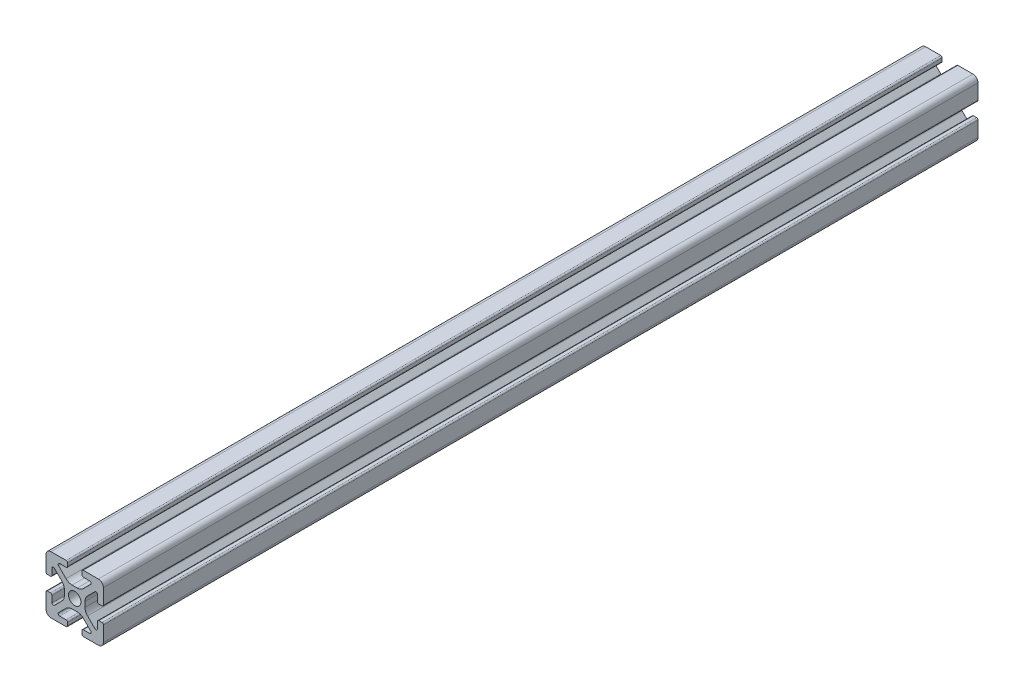
from build123d import *

# Parameters (mm, degrees)
BOSS_EXTRUDE1_DEPTH = 1524
SKETCH5_W           = 20
SKETCH5_H           = 2743.2
CUT_EXTRUDE1_DEPTH  = 1525.164033167


with BuildPart() as part:
    # Sketch4 → Boss-Extrude1 (new, symmetric)
    with BuildSketch(Plane.XY):
        with BuildLine():
            Line((3, -10), (8.25, -10))
            ThreePointArc((8.25, -10), (9.487436867, -9.487436867), (10, -8.25))
            Line((10, -8.25), (10, -3))
            ThreePointArc((10, -3), (9.853553391, -2.646446609), (9.5, -2.5))
            Line((9.5, -2.5), (8.424621202, -2.5))
            ThreePointArc((8.424621202, -2.5), (8.071067812, -2.646446609), (7.924621202, -3))
            Line((7.924621202, -3), (7.924621202, -5.25))
            ThreePointArc((7.924621202, -5.25), (7.615962919, -5.711939766), (7.071067812, -5.603553391))
            Line((7.071067812, -5.603553391), (4.478679656, -3.011165235))
            ThreePointArc((4.478679656, -3.011165235), (3.828361402, -2.037895189), (3.6, -0.889844892))
            Line((3.6, -0.889844892), (3.6, 0))
            Line((3.6, 0), (2.15, 0))
            ThreePointArc((2.15, 0), (1.52027958, -1.52027958), (0, -2.15))
            Line((0, -2.15), (0, -3.6))
            Line((0, -3.6), (0.889844892, -3.6))
            ThreePointArc((0.889844892, -3.6), (2.037895189, -3.828361402), (3.011165235, -4.478679656))
            Line((3.011165235, -4.478679656), (5.603553391, -7.071067812))
            ThreePointArc((5.603553391, -7.071067812), (5.711939766, -7.615962919), (5.25, -7.924621202))
            Line((5.25, -7.924621202), (3, -7.924621202))
            ThreePointArc((3, -7.924621202), (2.646446609, -8.071067812), (2.5, -8.424621202))
            Line((2.5, -8.424621202), (2.5, -9.5))
            ThreePointArc((2.5, -9.5), (2.646446609, -9.853553391), (3, -10))
        make_face()
    extrude(amount=BOSS_EXTRUDE1_DEPTH, both=True)

    # Mirror1: part across plane


with BuildPart() as part_1:
    add(part.part)
    add(part.part.mirror(Plane(origin=(0, 0, 0), x_dir=(0, 0, 1), z_dir=(1, 0, 0))))

    # Mirror2: part across plane


with BuildPart() as part_2:
    add(part_1.part)
    add(part_1.part.mirror(Plane.ZX))

    # Sketch5 → Cut-Extrude1 (cut, through all)
    with BuildSketch(Plane(origin=(0, 10, 0), x_dir=(1, 0, 0), z_dir=(0, 1, 0))):
        with Locations((0, -152.4)):
            Rectangle(SKETCH5_W, SKETCH5_H)
    extrude(amount=-CUT_EXTRUDE1_DEPTH, mode=Mode.SUBTRACT)


solid = part_2.part
